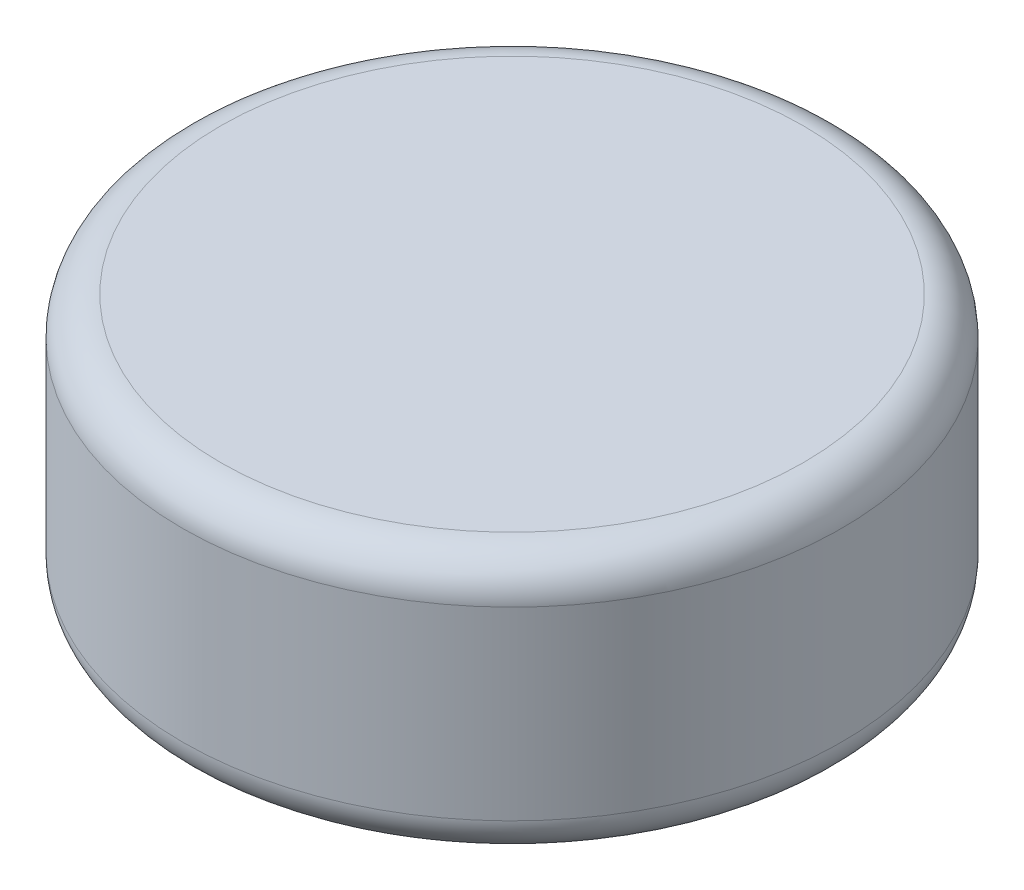
from build123d import *

# Parameters (mm, degrees)
SKETCH1_R           = 260
BOSS_EXTRUDE1_DEPTH = 206
FILLET1_R           = 30


with BuildPart() as part:
    # Sketch1 → Boss-Extrude1 (new body)
    with BuildSketch(Plane(origin=(0, 0, 0), x_dir=(1, 0, 0), z_dir=(0, 1, 0))):
        with Locations(Location((0, 0, 0), (0, 0, 270))):
            Circle(SKETCH1_R)
    extrude(amount=BOSS_EXTRUDE1_DEPTH)

    # Fillet1
    fillet1_edges = [part.edges().sort_by_distance(p)[0] for p in [
        (0, 0, -260),
        (0, 206, -260),
    ]]
    fillet(fillet1_edges, radius=FILLET1_R)


solid = part.part
